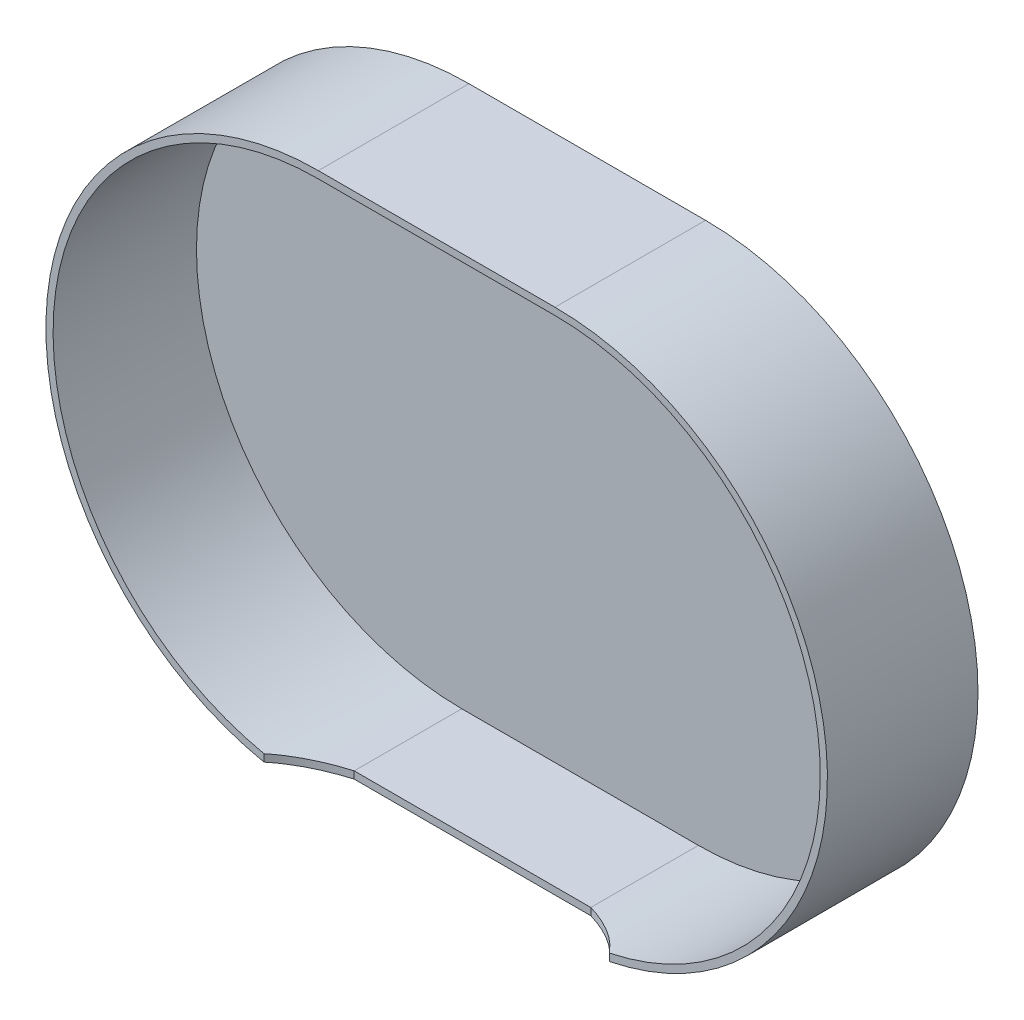
from build123d import *

# Parameters (mm, degrees)
EXTRUDE_1_DEPTH     = 1
EXTRUDE_2_DEPTH     = 20
CUT_EXTRUDE_1_DEPTH = 20


with BuildPart() as part:
    # 草图1 → 凸台-拉伸1 (new body)
    with BuildSketch(Plane.XY):
        with BuildLine():
            Line((0, 38), (33, 38))
            ThreePointArc((33, 38), (71, 0), (33, -38))
            Line((33, -38), (0, -38))
            ThreePointArc((0, -38), (-38, 0), (0, 38))
        make_face()
    extrude(amount=EXTRUDE_1_DEPTH)

    # 草图2 → 凸台-拉伸2 (add)
    with BuildSketch(Plane.XY.offset(1)):
        with BuildLine():
            Line((0, 38), (33, 38))
            ThreePointArc((33, 38), (71, 0), (33, -38))
            Line((33, -38), (0, -38))
            ThreePointArc((0, -38), (-38, 0), (0, 38))
        make_face()
        with BuildLine():
            Line((0, 37), (33, 37))
            ThreePointArc((33, 37), (70, 0), (33, -37))
            Line((33, -37), (0, -37))
            ThreePointArc((0, -37), (-37, 0), (0, 37))
        make_face(mode=Mode.SUBTRACT)
    extrude(amount=EXTRUDE_2_DEPTH)

    # 草图3 → 切除-拉伸1 (cut)
    with BuildSketch(Plane.XZ.offset(38)):
        Polygon((0, 16), (33, 16), (33, 21), (16.5, 21), (0, 21), align=None)
        with BuildLine():
            ThreePointArc((-7.575757576, 21), (-4.158348613, 17.938682084), (0, 16))
            Line((0, 16), (0, 21))
            Line((0, 21), (-7.575757576, 21))
        make_face()
        with BuildLine():
            Line((33, 21), (33, 16))
            ThreePointArc((33, 16), (37.158348613, 17.938682084), (40.575757576, 21))
            Line((40.575757576, 21), (33, 21))
        make_face()
    extrude(amount=-CUT_EXTRUDE_1_DEPTH, mode=Mode.SUBTRACT)


solid = part.part
